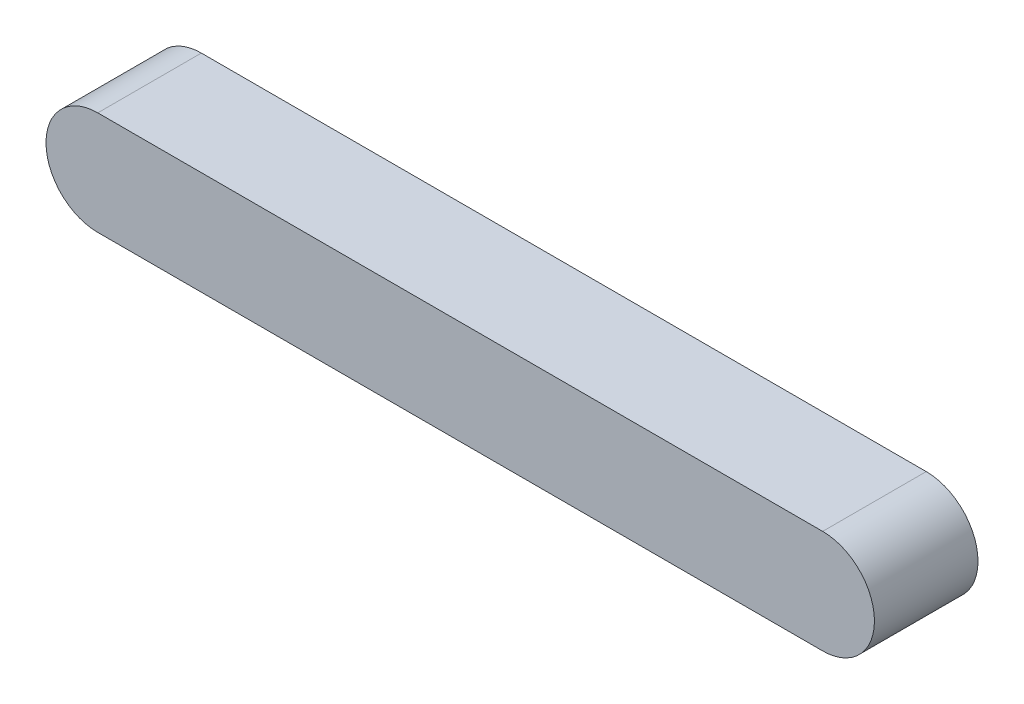
from build123d import *

# Parameters (mm, degrees)
BOSS_EXTRUDE1_DEPTH = 20


with BuildPart() as part:
    # Sketch1 → Boss-Extrude1 (new body)
    with BuildSketch(Plane.XY):
        with BuildLine():
            Line((-70, 10), (70, 10))
            ThreePointArc((70, 10), (80, 0), (70, -10))
            Line((70, -10), (-70, -10))
            ThreePointArc((-70, -10), (-80, 0), (-70, 10))
        make_face()
    extrude(amount=BOSS_EXTRUDE1_DEPTH)


solid = part.part
